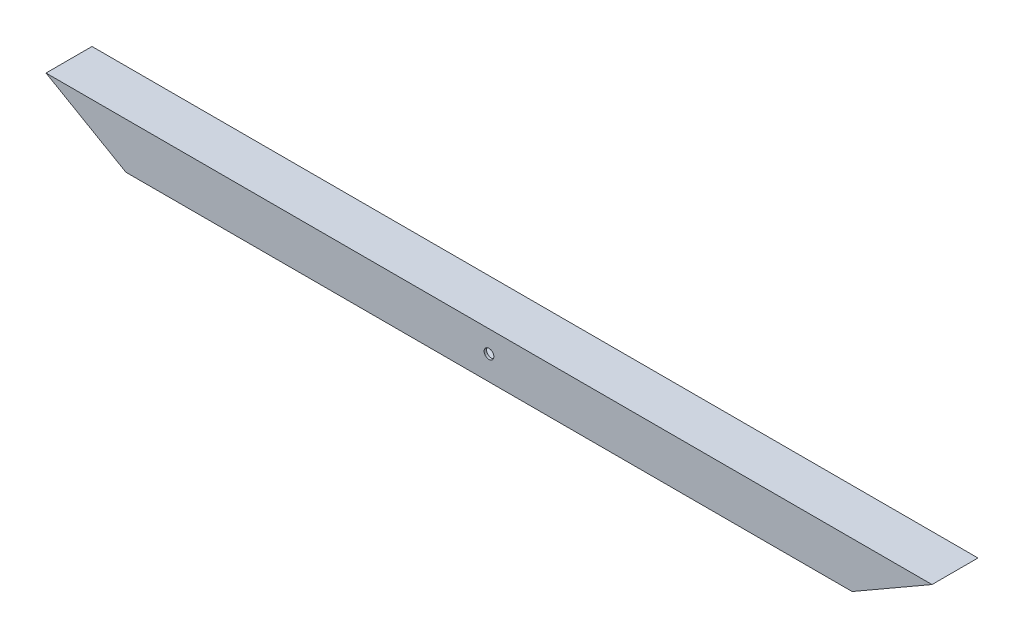
from build123d import *

# Parameters (mm, degrees)
SKETCH1_W           = 366
SKETCH1_H           = 19
BOSS_EXTRUDE2_DEPTH = 19
SKETCH9_W           = 17
SKETCH9_H           = 17
CUT_EXTRUDE4_DEPTH  = 367.985013318
CUT_EXTRUDE6_DEPTH  = 339.005366679
SKETCH12_R          = 2
CUT_EXTRUDE7_DEPTH  = 339.005366679


with BuildPart() as part:
    # Sketch1 → Boss-Extrude2 (new body)
    with BuildSketch(Plane(origin=(0, 0, 0), x_dir=(1, 0, 0), z_dir=(0, 1, 0))):
        with Locations((-153.935643564, 9.5)):
            Rectangle(SKETCH1_W, SKETCH1_H)
    extrude(amount=BOSS_EXTRUDE2_DEPTH)

    # Sketch9 → Cut-Extrude4 (cut, through all)
    with BuildSketch(Plane(origin=(29.064356436, 0, 0), x_dir=(0, 0, -1), z_dir=(1, 0, 0))):
        with Locations((9.5, 9.5)):
            Rectangle(SKETCH9_W, SKETCH9_H)
    extrude(amount=-CUT_EXTRUDE4_DEPTH, mode=Mode.SUBTRACT)

    # Sketch11 → Cut-Extrude6 (cut, through all)
    with BuildSketch(Plane(origin=(0, 0, -19), x_dir=(-1, 0, 0), z_dir=(0, 0, -1))):
        Polygon((-29.064356436, 19), (-29.064356436, 0), (3.935643564, 0), align=None)
        Polygon((336.935643564, 19), (336.935643564, 0), (303.935643564, 0), align=None)
    extrude(amount=-CUT_EXTRUDE6_DEPTH, mode=Mode.SUBTRACT)

    # Sketch12 → Cut-Extrude7 (cut, through all)
    with BuildSketch(Plane.XY):
        with Locations((-153.935643564, 10)):
            Circle(SKETCH12_R)
    extrude(amount=-CUT_EXTRUDE7_DEPTH, mode=Mode.SUBTRACT)


solid = part.part
